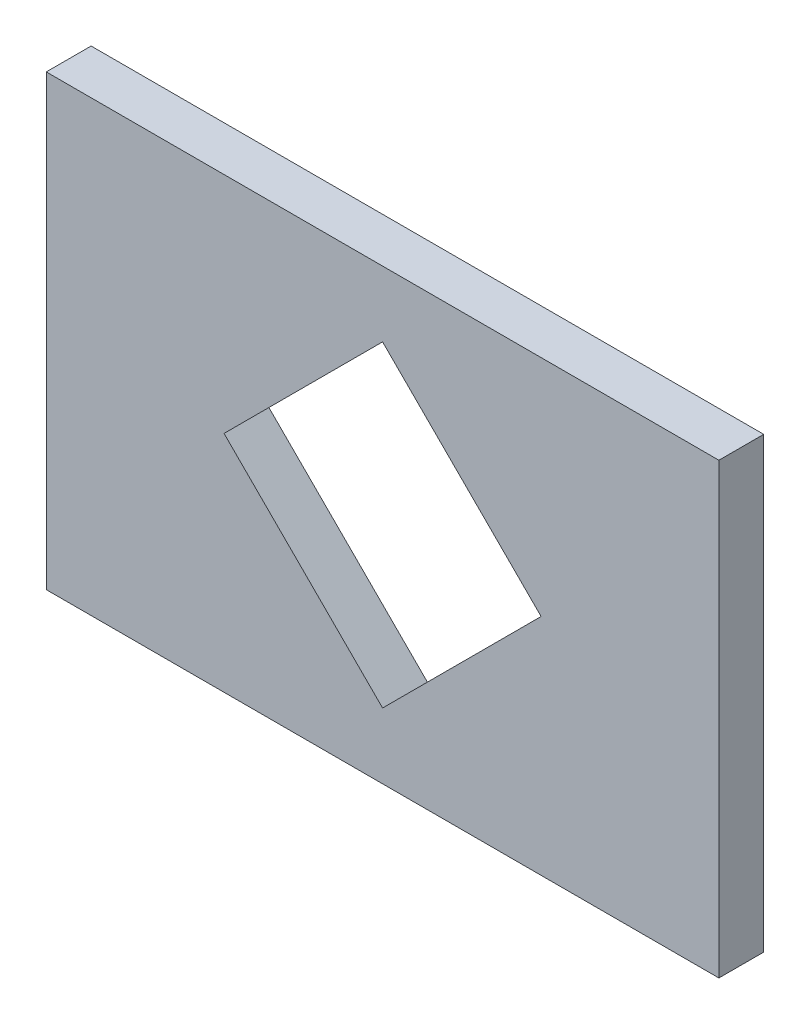
from build123d import *

# Parameters (mm, degrees)
SKETCH2_W           = 150
SKETCH2_H           = 100
BOSS_EXTRUDE1_DEPTH = 10


with BuildPart() as part:
    # Sketch2 → Boss-Extrude1 (new body)
    with BuildSketch(Plane.XY):
        Rectangle(SKETCH2_W, SKETCH2_H)
        Polygon((0, -35.355339059), (35.355339059, 0), (0, 35.355339059), (-35.355339059, 0), align=None, mode=Mode.SUBTRACT)
    extrude(amount=BOSS_EXTRUDE1_DEPTH)


solid = part.part
